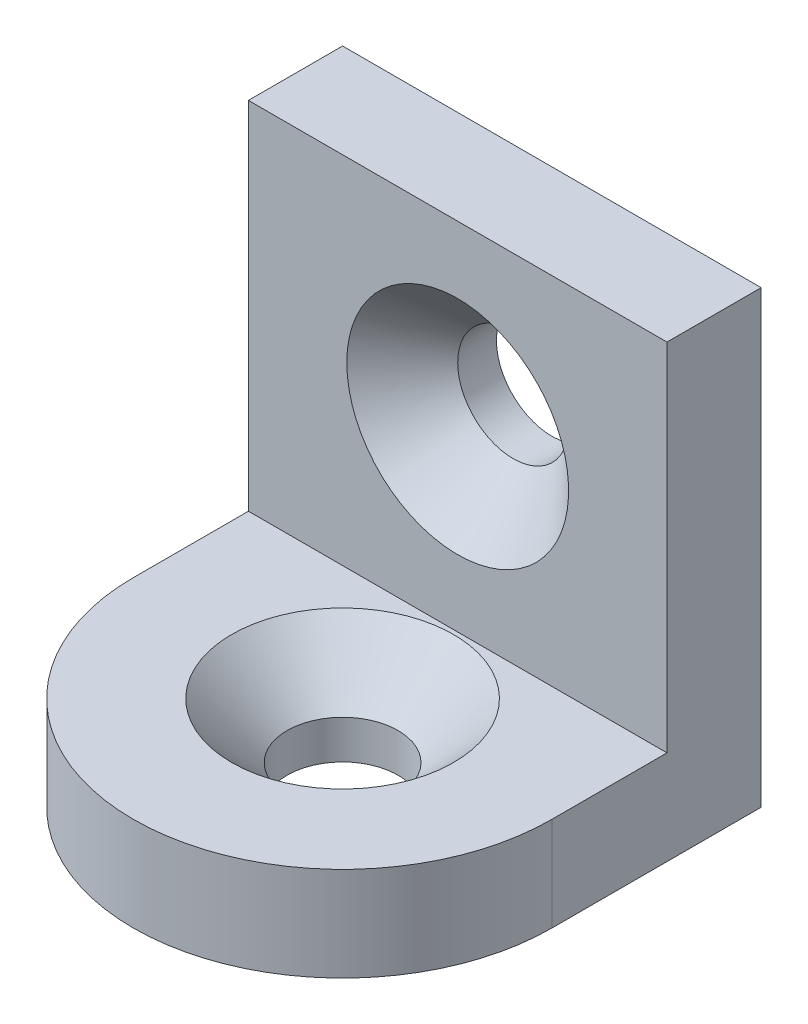
from build123d import *

# Parameters (mm, degrees)
SKETCH_1_R          = 10
SKETCH_1_R_2        = 2.65
EXTRUDE_1_DEPTH     = 4.5
SKETCH_2_W          = 20
SKETCH_2_H          = 4.5
EXTRUDE_2_DEPTH     = 17
SKETCH_3_R          = 2.65
CUT_EXTRUDE_1_DEPTH = 17
CHAMFER_1_SIZE      = 2.65


with BuildPart() as part:
    # 草图1 → 凸台-拉伸1 (new body)
    # profile 1 of 3: a face of its own
    with BuildSketch(Plane(origin=(0, 0, 0), x_dir=(1, 0, 0), z_dir=(0, 1, 0))):
        with BuildLine():
            Line((0, 10), (-10, 10))
            Line((-10, 10), (-10, 0))
            ThreePointArc((-10, 0), (-7.071067812, 7.071067812), (0, 10))
        make_face()
    # profile 2 of 3: a face of its own
    with BuildSketch(Plane(origin=(0, 0, 0), x_dir=(1, 0, 0), z_dir=(0, 1, 0))):
        with BuildLine():
            Line((10, 10), (0, 10))
            ThreePointArc((0, 10), (7.071067812, 7.071067812), (10, 0))
            Line((10, 0), (10, 10))
        make_face()
    # profile 3 of 3: a face of its own
    with BuildSketch(Plane(origin=(0, 0, 0), x_dir=(1, 0, 0), z_dir=(0, 1, 0))):
        Circle(SKETCH_1_R)
        with Locations(Location((0, 0, 0), (0, 0, 270))):
            Circle(SKETCH_1_R_2, mode=Mode.SUBTRACT)
    extrude(amount=EXTRUDE_1_DEPTH)

    # 草图2 → 凸台-拉伸2 (add)
    with BuildSketch(Plane(origin=(0, 4.5, 0), x_dir=(1, 0, 0), z_dir=(0, 1, 0))):
        with Locations((0, 7.75)):
            Rectangle(SKETCH_2_W, SKETCH_2_H)
    extrude(amount=EXTRUDE_2_DEPTH)

    # 草图3 → 切除-拉伸1 (cut)
    with BuildSketch(Plane.XY.offset(-5.5)):
        with Locations((0, 13)):
            Circle(SKETCH_3_R)
    extrude(amount=-CUT_EXTRUDE_1_DEPTH, mode=Mode.SUBTRACT)

    # 倒角1
    chamfer_1_edges = [part.edges().sort_by_distance(p)[0] for p in [
        (0, 4.5, -2.65),
        (-2.65, 13, -5.5),
    ]]
    chamfer(chamfer_1_edges, length=CHAMFER_1_SIZE)


solid = part.part
